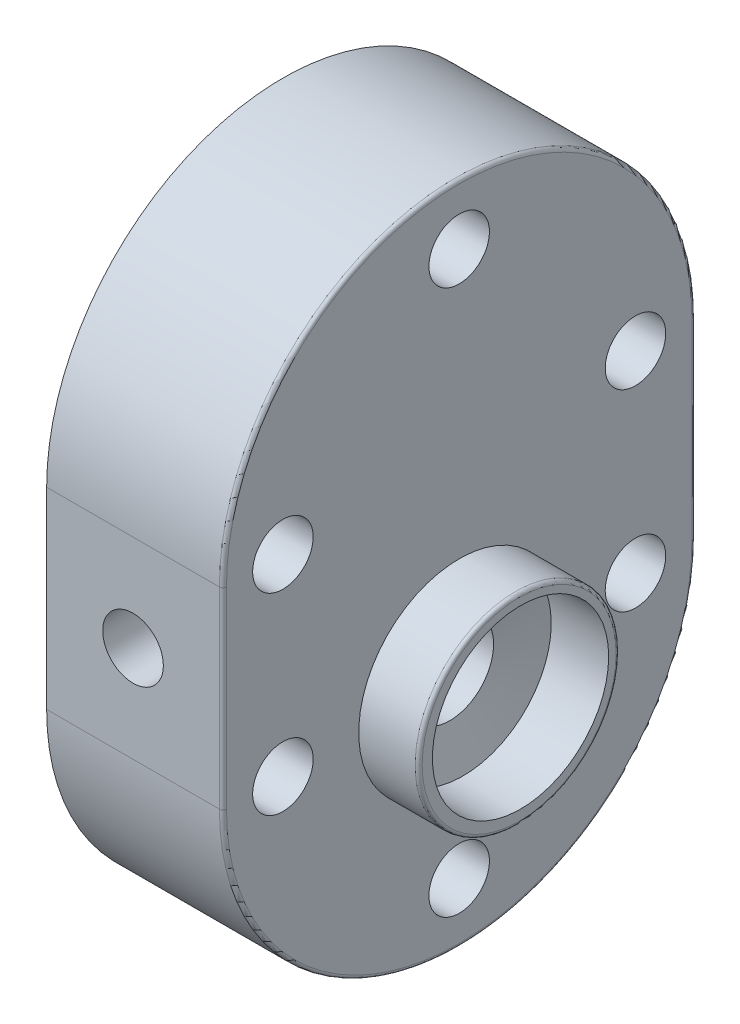
from build123d import *

# Parameters (mm, degrees)
BOSS_EXTRUDE1_DEPTH              = 63.5
SKETCH2_R                        = 10.9
CUT_EXTRUDE1_DEPTH               = 188.402765188
CUT_EXTRUDE2_DEPTH               = 38.1
SKETCH5_R                        = 36.195
BOSS_EXTRUDE2_DEPTH              = 21.59
F_97_2_5_DIAMETER_HOLE2_D        = 63.5
F_97_2_5_DIAMETER_HOLE2_DEPTH    = 20.69261314
F_97_2_5_DIAMETER_HOLE2_TIP      = 8.50738686
SKETCH11_R                       = 15.875
CUT_EXTRUDE3_DEPTH               = 183.470837396
F_97_1_25_DIAMETER_HOLE4_D       = 31.75
F_97_1_25_DIAMETER_HOLE4_DEPTH   = 9.24630657
F_97_1_25_DIAMETER_HOLE4_TIP     = 4.25369343
FILLET1_R                        = 1.27
F_1_16_1_25_DIAMETER_HOLE1_D     = 31.75
F_1_16_1_25_DIAMETER_HOLE1_DEPTH = 38.94630657
F_1_16_1_25_DIAMETER_HOLE1_TIP   = 4.25369343


with BuildPart() as part:
    # Sketch1 → Boss-Extrude1 (new body)
    with BuildSketch(Plane(origin=(0, 0, 0), x_dir=(0, 0, -1), z_dir=(1, 0, 0))):
        with BuildLine():
            Line((-85.1, 69.32), (-85.1, 0))
            ThreePointArc((-85.1, 0), (0, -85.1), (85.1, 0))
            Line((85.1, 0), (85.1, 69.32))
            ThreePointArc((85.1, 69.32), (0, 154.42), (-85.1, 69.32))
        make_face()
    extrude(amount=-BOSS_EXTRUDE1_DEPTH)

    # Sketch2 → Cut-Extrude1 (cut, through all)
    with BuildSketch(Plane(origin=(0, 0, 0), x_dir=(0, 0, -1), z_dir=(1, 0, 0))):
        with Locations((0, 132.83)):
            Circle(SKETCH2_R)
        with Locations((63.5, 69.33)):
            Circle(SKETCH2_R)
        with Locations(Location((-63.5, 69.33, 0), (0, 0, 180))):
            Circle(SKETCH2_R)
        with Locations(Location((63.5, -0.01, 0), (0, 0, 180))):
            Circle(SKETCH2_R)
        with Locations((-63.5, -0.01)):
            Circle(SKETCH2_R)
        with Locations(Location((0, -63.51, 0), (0, 0, 180))):
            Circle(SKETCH2_R)
    extrude(amount=-CUT_EXTRUDE1_DEPTH, mode=Mode.SUBTRACT)

    # Sketch3 → Cut-Extrude2 (cut)
    with BuildSketch(Plane.ZY.offset(63.5)):
        with BuildLine():
            ThreePointArc((-20.932552615, 34.671), (0, -40.5), (20.932552615, 34.671))
            ThreePointArc((20.932552615, 34.671), (0, 109.842), (-20.932552615, 34.671))
        make_face()
    extrude(amount=-CUT_EXTRUDE2_DEPTH, mode=Mode.SUBTRACT)

    # Sketch5 → Boss-Extrude2 (add)
    with BuildSketch(Plane(origin=(0, 0, 0), x_dir=(0, 0, -1), z_dir=(1, 0, 0))):
        Circle(SKETCH5_R)
    extrude(amount=BOSS_EXTRUDE2_DEPTH)

    # #97 (2.5) Diameter Hole2
    with Locations(Plane(origin=(21.59, 0.381274274, -0.515455507), x_dir=(0, 0, 1), z_dir=(1, 0, 0))):
        with Locations((0, 0)):
            Hole(F_97_2_5_DIAMETER_HOLE2_D / 2, depth=F_97_2_5_DIAMETER_HOLE2_DEPTH)
            with Locations((0, 0, -(F_97_2_5_DIAMETER_HOLE2_DEPTH + F_97_2_5_DIAMETER_HOLE2_TIP / 2))):  # 150° drill point
                Cone(0, F_97_2_5_DIAMETER_HOLE2_D / 2, F_97_2_5_DIAMETER_HOLE2_TIP, mode=Mode.SUBTRACT)

    # Sketch11 → Cut-Extrude3 (cut, through all)
    with BuildSketch(Plane.ZY.offset(25.4)):
        Circle(SKETCH11_R)
    extrude(amount=-CUT_EXTRUDE3_DEPTH, mode=Mode.SUBTRACT)

    # #97 (1.25) Diameter Hole4
    with Locations(Plane(origin=(-25.4, 69.342, 0), x_dir=(0, 0, -1), z_dir=(-1, 0, 0))):
        with Locations((0, 0)):
            Hole(F_97_1_25_DIAMETER_HOLE4_D / 2, depth=F_97_1_25_DIAMETER_HOLE4_DEPTH)
            with Locations((0, 0, -(F_97_1_25_DIAMETER_HOLE4_DEPTH + F_97_1_25_DIAMETER_HOLE4_TIP / 2))):  # 150° drill point
                Cone(0, F_97_1_25_DIAMETER_HOLE4_D / 2, F_97_1_25_DIAMETER_HOLE4_TIP, mode=Mode.SUBTRACT)

    # Fillet1
    fillet1_edges = [part.edges().sort_by_distance(p)[0] for p in [
        (0, 34.66, -85.1),
        (0, -85.1, 0),
        (0, 34.66, 85.1),
        (0, 154.42, 0),
        (21.59, 0, 36.195),
    ]]
    fillet(fillet1_edges, radius=FILLET1_R)

    # Sketch18 → 1/16 (0.86) Diameter Hole1 (revolve, cut)
    with BuildSketch(Plane(origin=(-32.385, 34.66, -85.1), x_dir=(0, 1, 0), z_dir=(1, 0, 0))):
        Polygon((0, 0), (0, 69), (10.922, 66.07345892), (10.922, 0), align=None)
    f_1_16_0_86_diameter_hole1 = revolve(axis=Axis((-32.385, 34.66, -91.45), (0, 0, 1)), mode=Mode.SUBTRACT)

    # Mirror1: 1/16 (0.86) Diameter Hole1 across plane
    add(f_1_16_0_86_diameter_hole1.mirror(Plane(origin=(0, 0, 0), x_dir=(1, 0, 0), z_dir=(0, 0, -1))), mode=Mode.SUBTRACT)

    # 1/16 (1.25) Diameter Hole1
    with Locations(Plane(origin=(-32.385, 34.66, -85.1), x_dir=(-1, 0, 0), z_dir=(0, 0, -1))):
        with Locations((0, 0)):
            Hole(F_1_16_1_25_DIAMETER_HOLE1_D / 2, depth=F_1_16_1_25_DIAMETER_HOLE1_DEPTH)
            with Locations((0, 0, -(F_1_16_1_25_DIAMETER_HOLE1_DEPTH + F_1_16_1_25_DIAMETER_HOLE1_TIP / 2))):  # 150° drill point
                Cone(0, F_1_16_1_25_DIAMETER_HOLE1_D / 2, F_1_16_1_25_DIAMETER_HOLE1_TIP, mode=Mode.SUBTRACT)


solid = part.part
